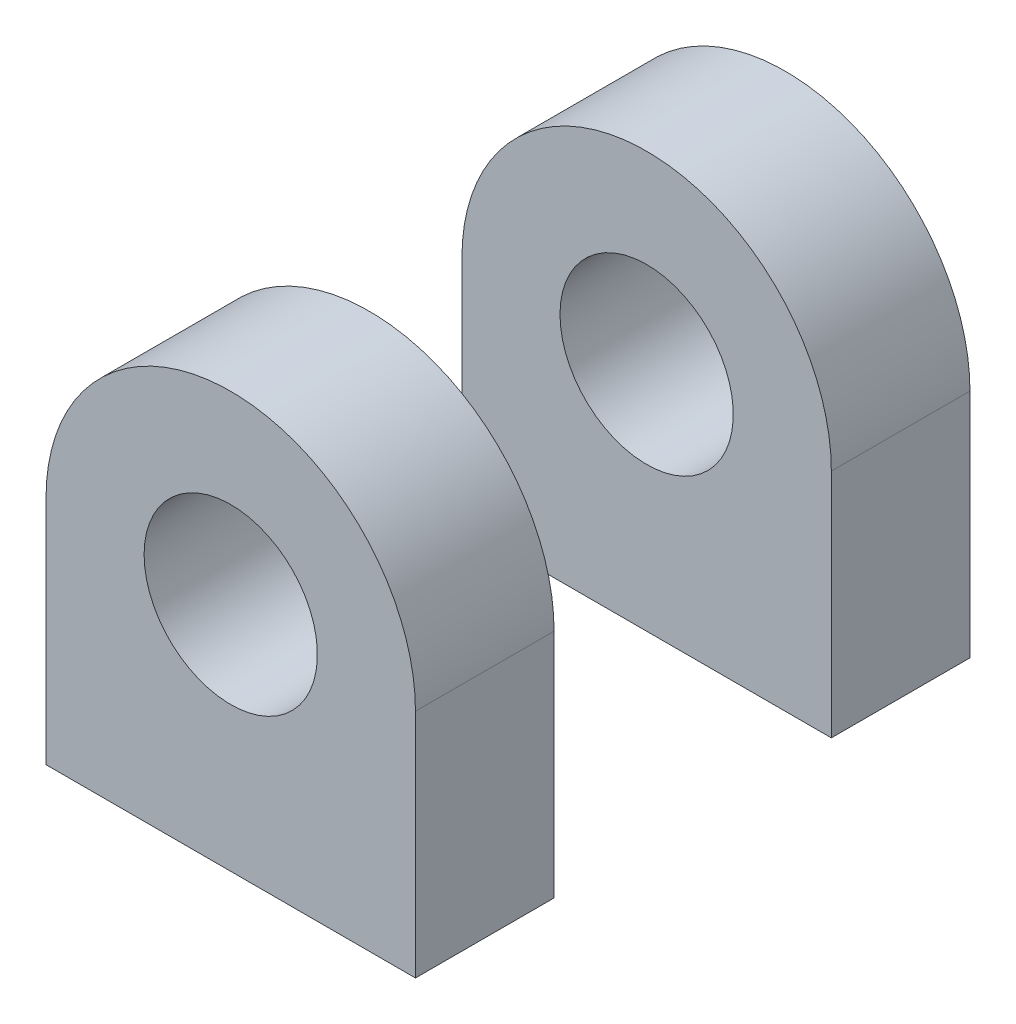
from build123d import *

# Parameters (mm, degrees)
SKETCH1_R           = 2.38125
BOSS_EXTRUDE1_DEPTH = 7.62
SKETCH2_W           = 7.62
SKETCH2_H           = 24.17124054
CUT_EXTRUDE1_DEPTH  = 25.4


with BuildPart() as part:
    # Sketch1 → Boss-Extrude1 (new, symmetric)
    with BuildSketch(Plane.XY):
        with BuildLine():
            ThreePointArc((0, 6.35), (5.076656873, 11.426656873), (10.153313745, 6.35))
            Line((10.153313745, 6.35), (10.153313745, 0))
            Line((10.153313745, 0), (0, 0))
            Line((0, 0), (0, 6.35))
        make_face()
        with Locations(Location((5.076656873, 6.35, 0), (0, 0, 180))):
            Circle(SKETCH1_R, mode=Mode.SUBTRACT)
    extrude(amount=BOSS_EXTRUDE1_DEPTH, both=True)

    # Sketch2 → Cut-Extrude1 (cut)
    with BuildSketch(Plane.ZY):
        with Locations((0, 12.08562027)):
            Rectangle(SKETCH2_W, SKETCH2_H)
    extrude(amount=-CUT_EXTRUDE1_DEPTH, mode=Mode.SUBTRACT)


with BuildPart() as cut_extrude1_piece_1:
    # of the separate pieces the step leaves, piece 1, a body of its own (cut_extrude1_pieces)
    add(part.part.solids().sort_by_distance((10.153313745, 6.35, -7.62))[0])


with BuildPart() as cut_extrude1_piece_2:
    # of the separate pieces the step leaves, piece 2, a body of its own (cut_extrude1_pieces)
    add(part.part.solids().sort_by_distance((10.153313745, 6.35, 3.81))[0])


solid = Compound([cut_extrude1_piece_1.part, cut_extrude1_piece_2.part])
